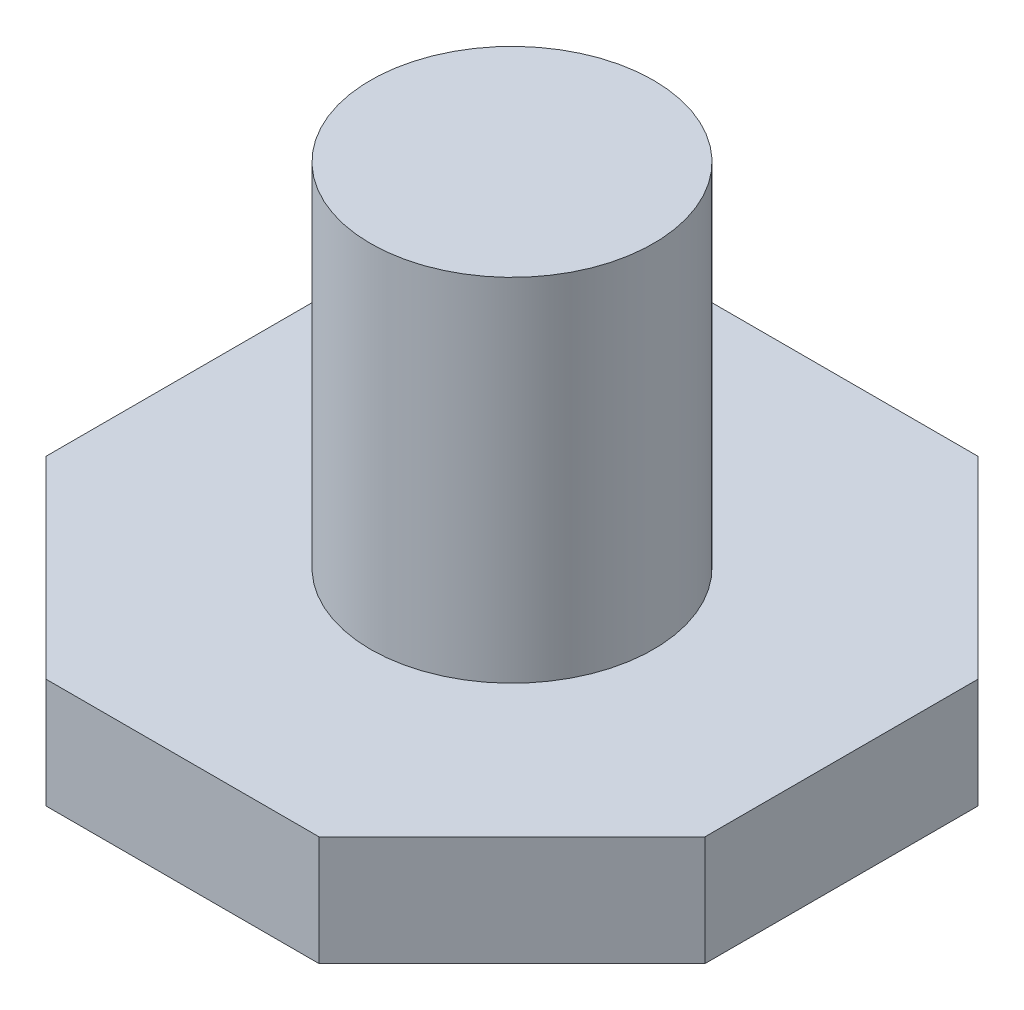
from build123d import *

# Parameters (mm, degrees)
BOSS_EXTRUDE1_DEPTH = 1.5875
SKETCH2_R           = 2.0447
BOSS_EXTRUDE3_DEPTH = 5.08


with BuildPart() as part:
    # Sketch1 → Boss-Extrude1 (new body)
    with BuildSketch(Plane(origin=(0, 0, 0), x_dir=(1, 0, 0), z_dir=(0, 1, 0))):
        Polygon((4.7625, -1.972692091), (4.7625, 1.972692091), (1.972692091, 4.7625), (-1.972692091, 4.7625), (-4.7625, 1.972692091), (-4.7625, -1.972692091), (-1.972692091, -4.7625), (1.972692091, -4.7625), align=None)
    extrude(amount=BOSS_EXTRUDE1_DEPTH)

    # Sketch2 → Boss-Extrude3 (add)
    with BuildSketch(Plane(origin=(0, 1.5875, 0), x_dir=(1, 0, 0), z_dir=(0, 1, 0))):
        with Locations(Location((0, 0, 0), (0, 0, 270))):
            Circle(SKETCH2_R)
    extrude(amount=BOSS_EXTRUDE3_DEPTH)


solid = part.part
